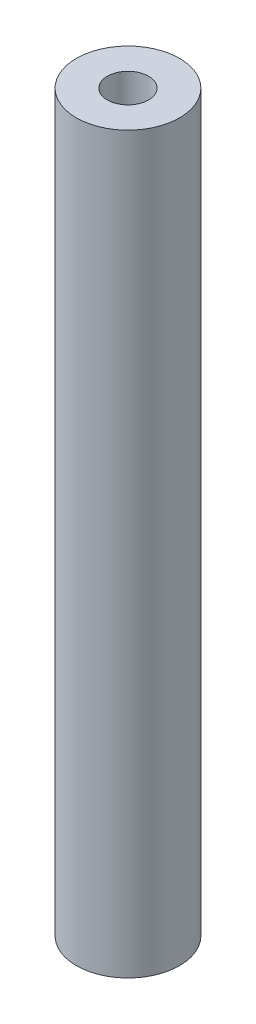
from build123d import *

# Parameters (mm, degrees)
SKETCH_1_R          = 6.25
EXTRUDE_1_DEPTH     = 89
SKETCH_2_R          = 2.5
CUT_EXTRUDE_1_DEPTH = 10
CUT_EXTRUDE_START   = -10
SKETCH_17_R         = 2.5
CUT_EXTRUDE_2_DEPTH = 10


with BuildPart() as part:
    # 草图1 → 凸台-拉伸1 (new body)
    with BuildSketch(Plane(origin=(0, 0, 0), x_dir=(1, 0, 0), z_dir=(0, 1, 0))):
        with Locations(Location((0, 0, 0), (0, 0, 270))):
            Circle(SKETCH_1_R)
    extrude(amount=EXTRUDE_1_DEPTH)

    # 草图2 → 切除-拉伸1 (cut)
    with BuildSketch(Plane(origin=(0, 89, 0), x_dir=(1, 0, 0), z_dir=(0, 1, 0))):
        with Locations(Location((0, 0, 0), (0, 0, 270))):
            Circle(SKETCH_2_R)
    extrude(amount=-CUT_EXTRUDE_1_DEPTH, mode=Mode.SUBTRACT)

    # 草图17 → 切除-拉伸2 (cut)
    with BuildSketch(Plane.XZ.offset(CUT_EXTRUDE_START)):
        with Locations(Location((0, 0, 0), (0, 0, 90))):
            Circle(SKETCH_17_R)
    extrude(amount=CUT_EXTRUDE_2_DEPTH, mode=Mode.SUBTRACT)


solid = part.part
